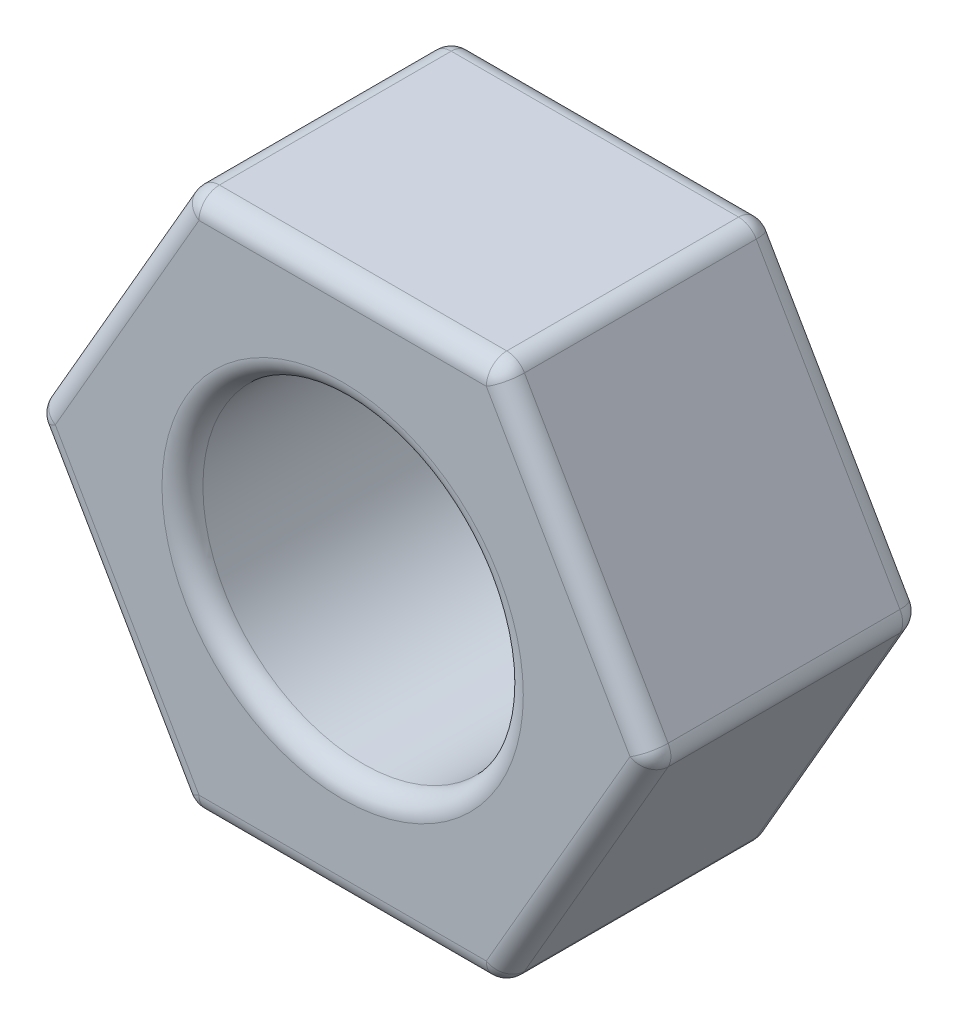
from build123d import *

# Parameters (mm, degrees)
ESBO_O1_R                = 2.35
RESSALTO_EXTRUS_O4_DEPTH = 4
FILETE2_R                = 0.3


with BuildPart() as part:
    # Esboço1 → Ressalto-extrusão4 (new body)
    with BuildSketch(Plane.XY):
        Polygon((-4.561067127, 0), (-2.280533563, -3.95), (2.280533563, -3.95), (4.561067127, 0), (2.280533563, 3.95), (-2.280533563, 3.95), align=None)
        Circle(ESBO_O1_R, mode=Mode.SUBTRACT)
    extrude(amount=RESSALTO_EXTRUS_O4_DEPTH)

    # Filete2
    filete2_edges = [part.edges().sort_by_distance(p)[0] for p in [
        (-2.280533563, 3.95, 2),
        (2.280533563, 3.95, 2),
        (4.561067127, 0, 2),
        (2.280533563, -3.95, 2),
        (-2.280533563, -3.95, 2),
        (-4.561067127, 0, 2),
        (0, -3.95, 4),
        (3.420800345, -1.975, 4),
        (-2.35, 0, 0),
        (-2.35, 0, 4),
        (3.420800345, 1.975, 4),
        (0, 3.95, 4),
        (-3.420800345, 1.975, 4),
        (0, 3.95, 0),
        (3.420800345, 1.975, 0),
        (3.420800345, -1.975, 0),
        (0, -3.95, 0),
        (-3.420800345, -1.975, 0),
        (-3.420800345, 1.975, 0),
        (-3.420800345, -1.975, 4),
    ]]
    fillet(filete2_edges, radius=FILETE2_R)


solid = part.part
